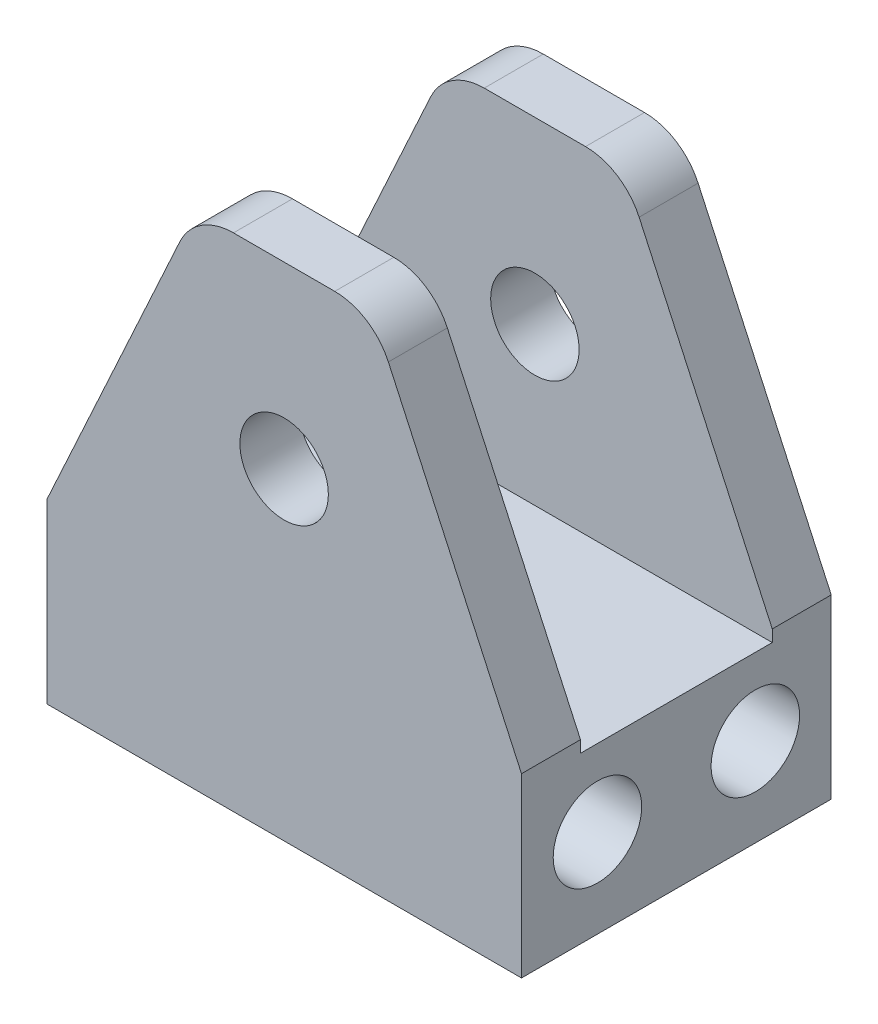
from build123d import *

# Parameters (mm, degrees)
BOSS_EXTRUDE1_DEPTH          = 44.45
BOSS_EXTRUDE1_DEPTH_BACK     = 9.525
SKETCH1_W                    = 51.1175
SKETCH1_H                    = 33.3502
SKETCH2_W                    = 51.1175
SKETCH2_H                    = 20.6502
CUT_EXTRUDE1_DEPTH           = 36.195
CUT_EXTRUDE2_DEPTH           = 62.166069365
CUT_EXTRUDE2_DEPTH_BACK      = 62.166069365
FILLET3_R                    = 6.35
F_3_8_0_375_DIAMETER_HOLE1_D = 9.525
F_3_8_0_375_DIAMETER_HOLE2_D = 9.525


with BuildPart() as part:
    # Sketch1 → Boss-Extrude1 (new, two sides: drawn at the far end of the back side and taken through both)
    with BuildSketch(Plane(origin=(0, 0, 0), x_dir=(1, 0, 0), z_dir=(0, 1, 0)).offset(-BOSS_EXTRUDE1_DEPTH_BACK)):
        Rectangle(SKETCH1_W, SKETCH1_H)
    extrude(amount=BOSS_EXTRUDE1_DEPTH + BOSS_EXTRUDE1_DEPTH_BACK)

    # Sketch2 → Cut-Extrude1 (cut)
    with BuildSketch(Plane(origin=(0, 44.45, 0), x_dir=(1, 0, 0), z_dir=(0, 1, 0))):
        Rectangle(SKETCH2_W, SKETCH2_H)
    extrude(amount=-CUT_EXTRUDE1_DEPTH, mode=Mode.SUBTRACT)

    # Sketch3 → Cut-Extrude2 (cut, two sides: drawn at the far end of the back side and taken through both)
    with BuildSketch(Plane(origin=(0, 0, -16.6751), x_dir=(-1, 0, 0), z_dir=(0, 0, -1)).offset(-CUT_EXTRUDE2_DEPTH_BACK)):
        Polygon((25.55875, 44.45), (9.525, 44.45), (25.55875, 9.525), align=None)
        Polygon((-25.55875, 9.525), (-9.525, 44.45), (-25.55875, 44.45), align=None)
    extrude(amount=CUT_EXTRUDE2_DEPTH + CUT_EXTRUDE2_DEPTH_BACK, mode=Mode.SUBTRACT)

    # Fillet3
    fillet3_edges = [part.edges().sort_by_distance(p)[0] for p in [
        (-9.525, 44.45, -13.5001),
        (-9.525, 44.45, 13.5001),
        (9.525, 44.45, -13.5001),
        (9.525, 44.45, 13.5001),
    ]]
    fillet(fillet3_edges, radius=FILLET3_R)

    # 3/8 (0.375) Diameter Hole1 (through all)
    with Locations(Plane.XY.offset(16.6751)):
        with Locations((0, 25.161662577)):
            Hole(F_3_8_0_375_DIAMETER_HOLE1_D / 2)

    # 3/8 (0.375) Diameter Hole2 (through all)
    with Locations(Plane.ZY.offset(25.55875)):
        with Locations((-8.5, 0), (8.5, 0)):
            Hole(F_3_8_0_375_DIAMETER_HOLE2_D / 2)


solid = part.part
